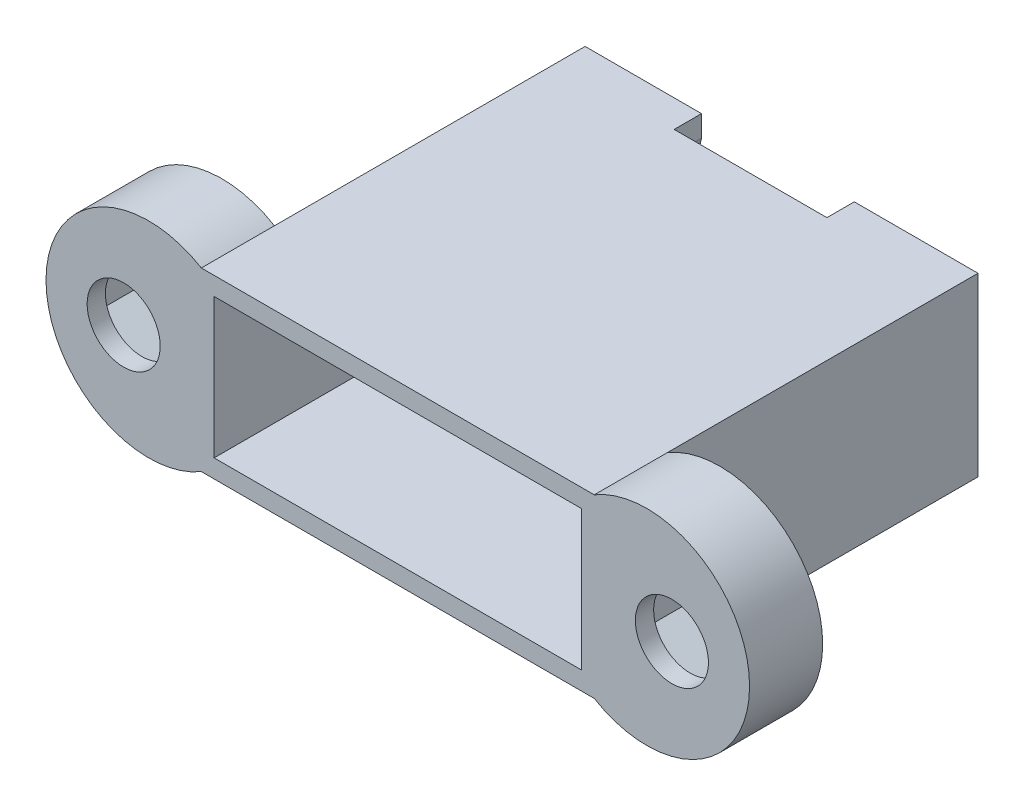
from build123d import *

# Parameters (mm, degrees)
SKETCH1_W           = 21.5
SKETCH1_H           = 9.65
BOSS_EXTRUDE1_DEPTH = 21
SKETCH3_W           = 20.1
SKETCH3_H           = 7.65
CUT_EXTRUDE1_DEPTH  = 19.6
CUT_EXTRUDE2_DEPTH  = 19.6
BOSS_EXTRUDE2_DEPTH = 4
CUT_EXTRUDE3_DEPTH  = 3
SKETCH22_R          = 2
CUT_EXTRUDE4_DEPTH  = 3
BOSS_EXTRUDE3_DEPTH = 4
CUT_EXTRUDE5_DEPTH  = 3
SKETCH25_R          = 2
CUT_EXTRUDE6_DEPTH  = 3
SKETCH26_W          = 8.360194132
SKETCH26_H          = 1.498091199
CUT_EXTRUDE7_DEPTH  = 2


with BuildPart() as part:
    # Sketch1 → Boss-Extrude1 (new body)
    with BuildSketch(Plane.XY):
        with Locations((0.67161215, 0.10146028)):
            Rectangle(SKETCH1_W, SKETCH1_H)
    extrude(amount=BOSS_EXTRUDE1_DEPTH)

    # Sketch3 → Cut-Extrude1 (cut)
    with BuildSketch(Plane.XY.offset(21)):
        with Locations((0.67161215, 0.10146028)):
            Rectangle(SKETCH3_W, SKETCH3_H)
    extrude(amount=-CUT_EXTRUDE1_DEPTH, mode=Mode.SUBTRACT)

    # Sketch5 → Cut-Extrude2 (cut)
    with BuildSketch(Plane.XY.offset(1.4)):
        with BuildLine():
            Line((-0.82838785, 5.92646028), (1.67161215, 5.92646028))
            ThreePointArc((1.67161215, 5.92646028), (4.67161215, 2.92646028), (1.67161215, -0.07353972))
            Line((1.67161215, -0.07353972), (-0.82838785, -0.07353972))
            ThreePointArc((-0.82838785, -0.07353972), (-3.82838785, 2.92646028), (-0.82838785, 5.92646028))
        make_face()
    extrude(amount=-CUT_EXTRUDE2_DEPTH, mode=Mode.SUBTRACT)

    # Sketch20 → Boss-Extrude2 (add)
    with BuildSketch(Plane.XY.offset(21)):
        with BuildLine():
            Line((-10.07838785, -4.72353972), (-10.07838785, 4.92646028))
            ThreePointArc((-10.07838785, 4.92646028), (-18.57838785, 0.10146028), (-10.07838785, -4.72353972))
        make_face()
    extrude(amount=-BOSS_EXTRUDE2_DEPTH)

    # Sketch21 → Cut-Extrude3 (cut)
    with BuildSketch(Plane(origin=(0, 0, 17), x_dir=(-1, 0, 0), z_dir=(0, 0, -1))):
        Polygon((14.32838785, 3.85146028), (11.080792586, 1.97646028), (11.080792586, -1.77353972), (14.32838785, -3.64853972), (17.575983115, -1.77353972), (17.575983115, 1.97646028), align=None)
    extrude(amount=-CUT_EXTRUDE3_DEPTH, mode=Mode.SUBTRACT)

    # Sketch22 → Cut-Extrude4 (cut)
    with BuildSketch(Plane(origin=(0, 0, 20), x_dir=(-1, 0, 0), z_dir=(0, 0, -1))):
        with Locations((14.32838785, 0.10146028)):
            Circle(SKETCH22_R)
    extrude(amount=-CUT_EXTRUDE4_DEPTH, mode=Mode.SUBTRACT)

    # Sketch23 → Boss-Extrude3 (add)
    with BuildSketch(Plane.XY.offset(21)):
        with BuildLine():
            Line((11.42161215, 4.92646028), (11.42161215, -4.72353972))
            ThreePointArc((11.42161215, -4.72353972), (19.92161215, 0.10146028), (11.42161215, 4.92646028))
        make_face()
    extrude(amount=-BOSS_EXTRUDE3_DEPTH)

    # Sketch24 → Cut-Extrude5 (cut)
    with BuildSketch(Plane(origin=(0, 0, 17), x_dir=(-1, 0, 0), z_dir=(0, 0, -1))):
        Polygon((-15.67161215, 3.85146028), (-18.919207414, 1.97646028), (-18.919207414, -1.77353972), (-15.67161215, -3.64853972), (-12.424016885, -1.77353972), (-12.424016885, 1.97646028), align=None)
    extrude(amount=-CUT_EXTRUDE5_DEPTH, mode=Mode.SUBTRACT)

    # Sketch25 → Cut-Extrude6 (cut)
    with BuildSketch(Plane(origin=(0, 0, 20), x_dir=(-1, 0, 0), z_dir=(0, 0, -1))):
        with Locations((-15.67161215, 0.10146028)):
            Circle(SKETCH25_R)
    extrude(amount=-CUT_EXTRUDE6_DEPTH, mode=Mode.SUBTRACT)

    # Sketch26 → Cut-Extrude7 (cut)
    with BuildSketch(Plane(origin=(0, 4.92646028, 0), x_dir=(1, 0, 0), z_dir=(0, 1, 0))):
        with Locations((0.472258252, -0.7490456)):
            Rectangle(SKETCH26_W, SKETCH26_H)
    extrude(amount=-CUT_EXTRUDE7_DEPTH, mode=Mode.SUBTRACT)


solid = part.part
